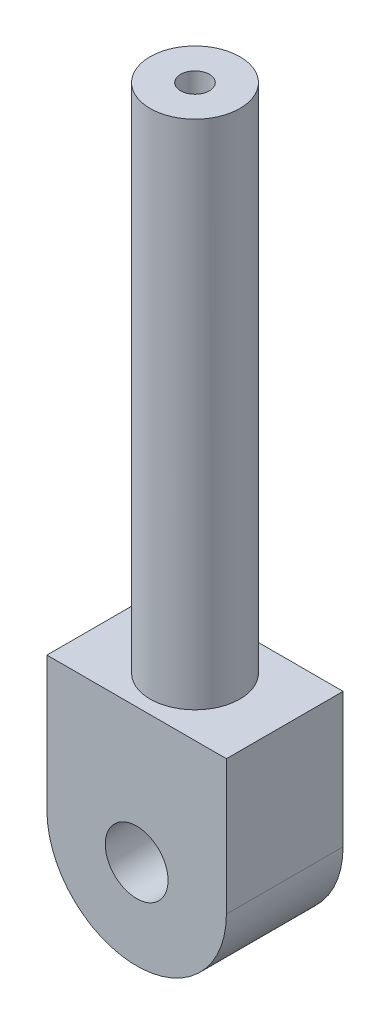
from build123d import *

# Parameters (mm, degrees)
ESBO_O1_R                = 3.5
RESSALTO_EXTRUS_O1_DEPTH = 13
ESBO_O2_R                = 5
RESSALTO_EXTRUS_O2_DEPTH = 57
ESBO_O3_R                = 1.6
CORTE_EXTRUS_O1_DEPTH    = 34


with BuildPart() as part:
    # Esboço1 → Ressalto-extrusão1 (new body)
    with BuildSketch(Plane.XY):
        with BuildLine():
            Line((-10, 0), (-10, 15))
            Line((-10, 15), (10, 15))
            Line((10, 15), (10, 0))
            ThreePointArc((10, 0), (0, -10), (-10, 0))
        make_face()
        with Locations(Location((0, 0, 0), (0, 0, 180))):
            Circle(ESBO_O1_R, mode=Mode.SUBTRACT)
    extrude(amount=RESSALTO_EXTRUS_O1_DEPTH)

    # Esboço2 → Ressalto-extrusão2 (add)
    with BuildSketch(Plane(origin=(0, 15, 0), x_dir=(1, 0, 0), z_dir=(0, 1, 0))):
        with Locations(Location((0, -6.5, 0), (0, 0, 90))):
            Circle(ESBO_O2_R)
    extrude(amount=RESSALTO_EXTRUS_O2_DEPTH)

    # Esboço3 → Corte-extrusão1 (cut)
    with BuildSketch(Plane(origin=(0, 72, 0), x_dir=(1, 0, 0), z_dir=(0, 1, 0))):
        with Locations(Location((0, -6.5, 0), (0, 0, 180))):
            Circle(ESBO_O3_R)
    extrude(amount=-CORTE_EXTRUS_O1_DEPTH, mode=Mode.SUBTRACT)


solid = part.part
